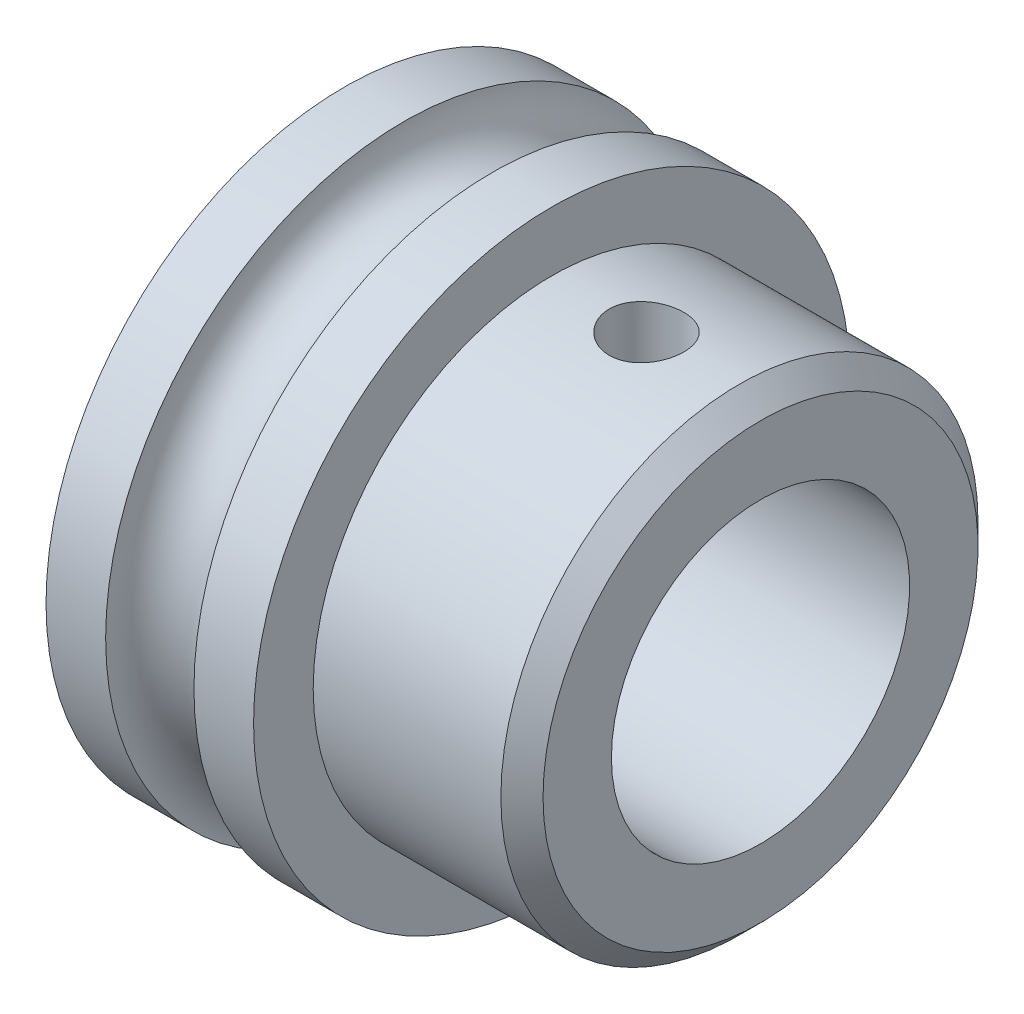
from build123d import *

# Parameters (mm, degrees)
SKETCH2_R          = 0.79375
CUT_EXTRUDE1_DEPTH = 13.61848379


with BuildPart() as part:
    # Sketch1 → Revolve1 (revolve)
    with BuildSketch(Plane(origin=(0, 0, 0), x_dir=(1, 0, 0), z_dir=(0, 1, 0)), mode=Mode.PRIVATE) as revolve1_sk:
        with BuildLine():
            Line((-8.8646, 3.175), (0, 3.175))
            Line((0, 3.175), (0, 4.630987194))
            Line((0, 4.630987194), (-0.449012806, 5.08))
            Line((-0.449012806, 5.08), (-4.445, 5.08))
            Line((-4.445, 5.08), (-4.445, 6.35))
            Line((-4.445, 6.35), (-5.715, 6.35))
            ThreePointArc((-5.715, 6.35), (-6.6548, 5.4102), (-7.5946, 6.35))
            Line((-7.5946, 6.35), (-8.8646, 6.35))
            Line((-8.8646, 6.35), (-8.8646, 3.175))
        make_face()
    revolve(revolve1_sk.sketch.rotate(Axis((-10.922, 0, 0), (1, 0, 0)), 180), axis=Axis((-10.922, 0, 0), (1, 0, 0)))

    # Sketch2 → Cut-Extrude1 (cut, through all)
    with BuildSketch(Plane(origin=(0, 0, 0), x_dir=(1, 0, 0), z_dir=(0, 1, 0))):
        with Locations(Location((-2.427185556, 0, 0), (0, 0, 90))):
            Circle(SKETCH2_R)
    extrude(amount=CUT_EXTRUDE1_DEPTH, mode=Mode.SUBTRACT)


solid = part.part
